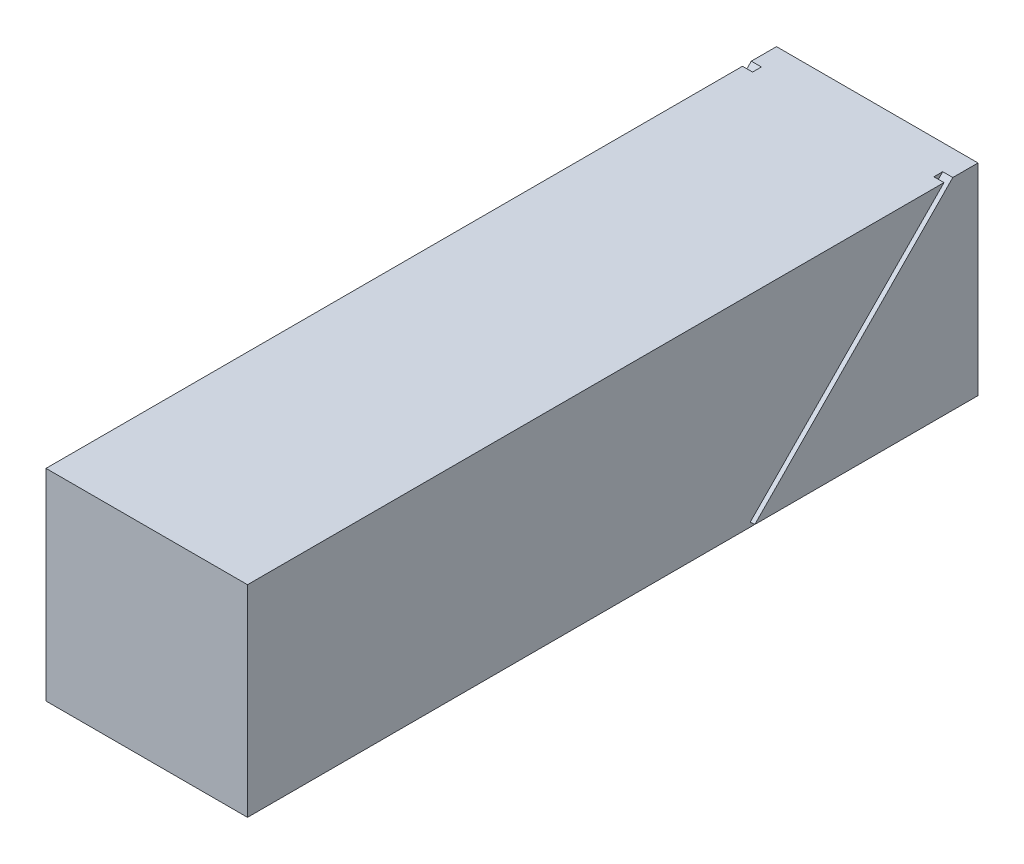
from build123d import *

# Parameters (mm, degrees)
SKETCH1_W           = 50.8
SKETCH1_H           = 50.8
BOSS_EXTRUDE1_DEPTH = 184.15
CUT_EXTRUDE1_DEPTH  = 2.54
CUT_EXTRUDE2_START  = -50.8
CUT_EXTRUDE2_DEPTH  = 2.54


with BuildPart() as part:
    # Sketch1 → Boss-Extrude1 (new body)
    with BuildSketch(Plane.XY):
        with Locations((25.4, 25.4)):
            Rectangle(SKETCH1_W, SKETCH1_H)
    extrude(amount=BOSS_EXTRUDE1_DEPTH)

    # Sketch2 → Cut-Extrude1 (cut)
    with BuildSketch(Plane(origin=(50.8, 0, 0), x_dir=(0, 0, -1), z_dir=(1, 0, 0))):
        Polygon((-56.271020966, 0), (-6.35, 50.8), (-8.575725903, 50.8), (-57.403306054, 1.112693457), (-56.529493244, 0.254), (-56.529493244, 0), align=None)
    extrude(amount=-CUT_EXTRUDE1_DEPTH, mode=Mode.SUBTRACT)

    # Sketch2<2> → Cut-Extrude2 (cut)
    with BuildSketch(Plane(origin=(50.8, 0, 0), x_dir=(0, 0, -1), z_dir=(1, 0, 0)).offset(CUT_EXTRUDE2_START)):
        Polygon((-56.271020966, 0), (-6.35, 50.8), (-8.575725903, 50.8), (-57.403306054, 1.112693457), (-56.529493244, 0.254), (-56.529493244, 0), align=None)
    extrude(amount=CUT_EXTRUDE2_DEPTH, mode=Mode.SUBTRACT)


solid = part.part
